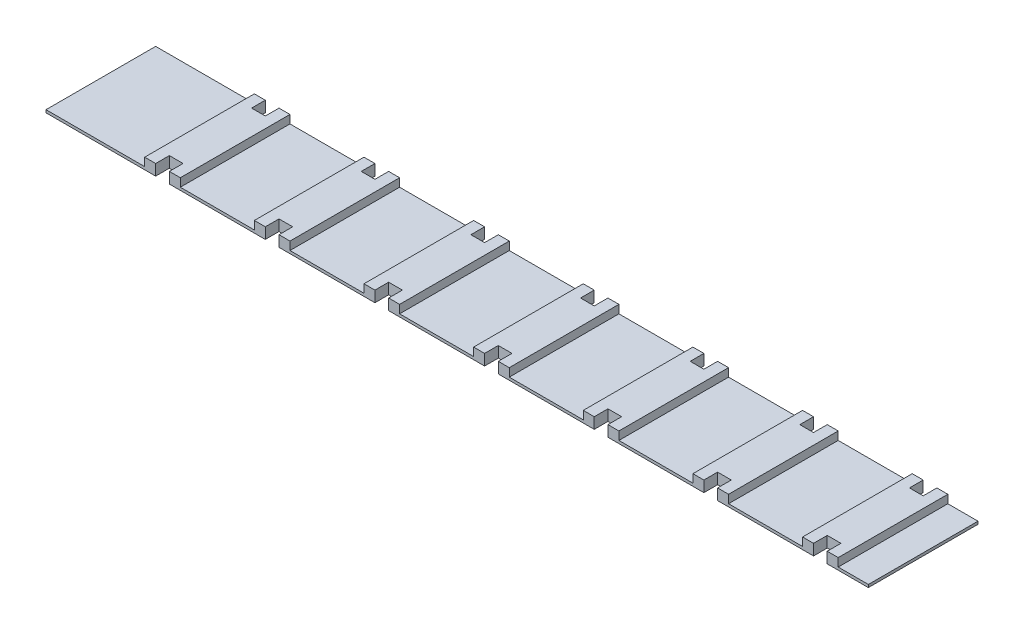
from build123d import *

# Parameters (mm, degrees)
BOSS_EXTRUDE1_DEPTH = 0.5
BOSS_EXTRUDE2_DEPTH = 1.5


with BuildPart() as part:
    # Sketch1 → Boss-Extrude1 (new body)
    with BuildSketch(Plane(origin=(0, 0, 0), x_dir=(1, 0, 0), z_dir=(0, 1, 0))):
        Polygon((40, 0), (40, 2.5), (42.5, 2.5), (42.5, 0), (60, 0), (60, 2.5), (62.5, 2.5), (62.5, 0), (80, 0), (80, 2.5), (82.5, 2.5), (82.5, 0), (100, 0), (100, 2.5), (102.5, 2.5), (102.5, 0), (120, 0), (120, 2.5), (122.5, 2.5), (122.5, 0), (140, 0), (140, 2.5), (142.5, 2.5), (142.5, 0), (150, 0), (150, 20), (142.5, 20), (142.5, 17.5), (140, 17.5), (140, 20), (122.5, 20), (122.5, 17.5), (120, 17.5), (120, 20), (102.5, 20), (102.5, 17.5), (100, 17.5), (100, 20), (82.5, 20), (82.5, 17.5), (80, 17.5), (80, 20), (62.5, 20), (62.5, 17.5), (60, 17.5), (60, 20), (42.5, 20), (42.5, 17.5), (40, 17.5), (40, 20), (22.5, 20), (22.5, 17.5), (20, 17.5), (20, 20), (0, 20), (0, 0), (20, 0), (20, 2.5), (22.5, 2.5), (22.5, 0), align=None)
    extrude(amount=BOSS_EXTRUDE1_DEPTH)

    # Sketch2 → Boss-Extrude2 (add)
    with BuildSketch(Plane(origin=(0, 0.5, 0), x_dir=(1, 0, 0), z_dir=(0, 1, 0))):
        Polygon((20, 20), (18, 20), (18, 0), (20, 0), (20, 2.5), (22.5, 2.5), (22.5, 0), (24.5, 0), (24.5, 20), (22.5, 20), (22.5, 17.5), (20, 17.5), align=None)
        Polygon((40, 17.5), (40, 20), (38, 20), (38, 0), (40, 0), (40, 2.5), (42.5, 2.5), (42.5, 0), (44.5, 0), (44.5, 20), (42.5, 20), (42.5, 17.5), align=None)
        Polygon((60, 17.5), (60, 20), (58, 20), (58, 0), (60, 0), (60, 2.5), (62.5, 2.5), (62.5, 0), (64.5, 0), (64.5, 20), (62.5, 20), (62.5, 17.5), align=None)
        Polygon((80, 17.5), (80, 20), (78, 20), (78, 0), (80, 0), (80, 2.5), (82.5, 2.5), (82.5, 0), (84.5, 0), (84.5, 20), (82.5, 20), (82.5, 17.5), align=None)
        Polygon((100, 17.5), (100, 20), (98, 20), (98, 0), (100, 0), (100, 2.5), (102.5, 2.5), (102.5, 0), (104.5, 0), (104.5, 20), (102.5, 20), (102.5, 17.5), align=None)
        Polygon((120, 17.5), (120, 20), (118, 20), (118, 0), (120, 0), (120, 2.5), (122.5, 2.5), (122.5, 0), (124.5, 0), (124.5, 20), (122.5, 20), (122.5, 17.5), align=None)
        Polygon((140, 17.5), (140, 20), (138, 20), (138, 0), (140, 0), (140, 2.5), (142.5, 2.5), (142.5, 0), (144.5, 0), (144.5, 20), (142.5, 20), (142.5, 17.5), align=None)
    extrude(amount=BOSS_EXTRUDE2_DEPTH)


solid = part.part
